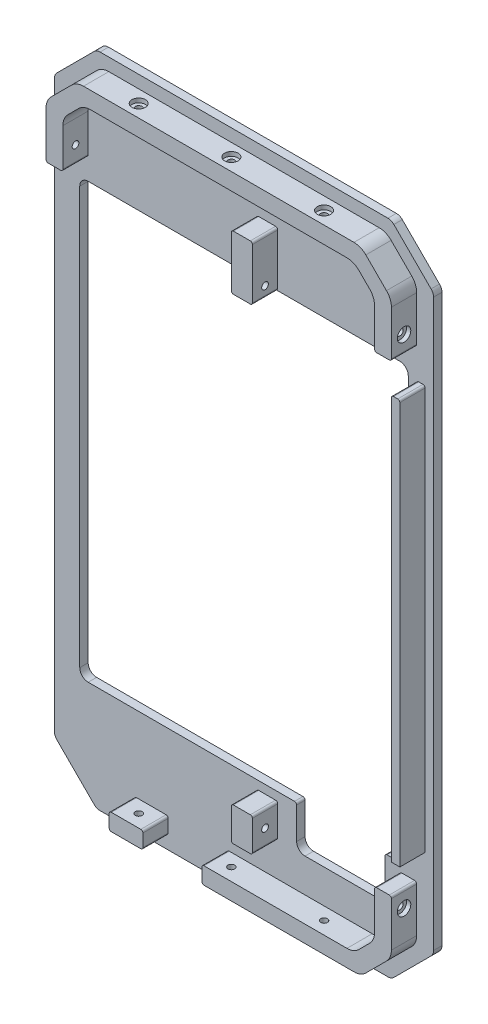
from build123d import *

# Parameters (mm, degrees)
SKETCH_1_W                = 90
SKETCH_1_H                = 156
EXTRUDE_1_DEPTH           = 2
CHAMFER_1_SIZE            = 10
EXTRUDE_2_DEPTH           = 6
SHELL_3_T                 = -4
SHELL_3_THICKNESS_2_DEPTH = 2
SKETCH_5_R                = 0.8
CUT_EXTRUDE_2088_DEPTH    = 200
SKETCH_25_W               = 15.521102544
SKETCH_25_H               = 165.941128128
SKETCH_25_W_2             = 34.04372952
CUT_EXTRUDE_17_DEPTH      = 6
SKETCH_8_W                = 109.527726605
SKETCH_8_H                = 110
CUT_EXTRUDE_3357_DEPTH    = 6
EXTRUDE_5_DEPTH           = 6
FILLET_4312_R             = 2
FILLET_4896_R             = 4
SKETCH_4_R                = 0.8
CUT_EXTRUDE_5906_DEPTH    = 100
SKETCH_6_W                = 5
SKETCH_6_H                = 13
SKETCH_6_H_2              = 8
EXTRUDE_3_DEPTH           = 6
CUT_EXTRUDE_START         = -10
SKETCH_17_R               = 0.8
CUT_EXTRUDE_7436_DEPTH    = 10
SKETCH_11_W               = 14
SKETCH_11_H               = 18.940292979
SKETCH_11_W_2             = 19
SKETCH_11_H_2             = 39.158001539
PCI_E_DEPTH               = 6
SKETCH_10_W               = 78
SKETCH_10_H               = 103
IO_2_DEPTH                = 10
SKETCH_15_W               = 21
SKETCH_15_H               = 10
CUT_EXTRUDE_10858_DEPTH   = 10
SKETCH_21_R               = 1.6
CUT_EXTRUDE_14_DEPTH      = 1
CUT_EXTRUDE_START_2       = -1
SKETCH_20_R               = 1.6
CUT_EXTRUDE_12604_DEPTH   = 1
SKETCH_22_R               = 1.6
CUT_EXTRUDE_15_DEPTH      = 1
SKETCH_23_R               = 1.6
CUT_EXTRUDE_16_DEPTH      = 1
SKETCH_26_W               = 2
SKETCH_26_H               = 96
EXTRUDE_4_DEPTH           = 6
FILLET_5_R                = 2
FILLET_7_R                = 0.5
FILLET_8_R                = 0.5


with BuildPart() as part:
    # 草图1 → 凸台-拉伸1 (new body)
    with BuildSketch(Plane.XY):
        with Locations((-45, 78)):
            Rectangle(SKETCH_1_W, SKETCH_1_H)
    extrude(amount=EXTRUDE_1_DEPTH)

    # 倒角1
    chamfer_1_edges = [part.edges().sort_by_distance(p)[0] for p in [
        (0, 0, 1),
        (-90, 0, 1),
        (-90, 156, 1),
        (0, 156, 1),
    ]]
    chamfer(chamfer_1_edges, length=CHAMFER_1_SIZE)

    # 草图2 → 凸台-拉伸2 (add)
    with BuildSketch(Plane.XY.offset(2)):
        Polygon((-78.757359313, 153), (-11.242640687, 153), (-3, 144.757359313), (-3, 11.242640687), (-11.242640687, 3), (-78.757359313, 3), (-87, 11.242640687), (-87, 144.757359313), align=None)
    extrude(amount=EXTRUDE_2_DEPTH)

    # 抽壳3
    shell_3_openings = [part.faces().sort_by_distance(p)[0] for p in [
        (-45, 78, 8),
    ]]
    offset(amount=SHELL_3_T, openings=shell_3_openings)

    # 抽壳3 thickness 2 face (on inner face of the shell) → 抽壳3 thickness 2 (cut)
    with BuildSketch(Plane(origin=(-45, 78, 4), x_dir=(-1, 0, 0), z_dir=(0, 0, -1))):
        Polygon((-32.100505063, 71), (32.100505063, 71), (38, 65.100505063), (38, -65.100505063), (32.100505063, -71), (-32.100505063, -71), (-38, -65.100505063), (-38, 65.100505063), align=None)
    extrude(amount=SHELL_3_THICKNESS_2_DEPTH, mode=Mode.SUBTRACT)

    # 草图5 → Cut-Extrude 2088 (cut)
    with BuildSketch(Plane(origin=(0, 3, 0), x_dir=(-1, 0, 0), z_dir=(0, -1, 0))):
        with Locations(Location((67, -5, 0), (0, 0, 90))):
            Circle(SKETCH_5_R)
        with Locations(Location((23, -5, 0), (0, 0, 90))):
            Circle(SKETCH_5_R)
        with Locations(Location((45, -5, 0), (0, 0, 90))):
            Circle(SKETCH_5_R)
    extrude(amount=-CUT_EXTRUDE_2088_DEPTH, mode=Mode.SUBTRACT)

    # 草图25 → 切除-拉伸17 (cut)
    with BuildSketch(Plane.XY.offset(8)):
        with Locations((-93.760551272, 70.734849479)):
            Rectangle(SKETCH_25_W, SKETCH_25_H)
        with Locations((13.02186476, 70.734849479)):
            Rectangle(SKETCH_25_W_2, SKETCH_25_H)
    extrude(amount=-CUT_EXTRUDE_17_DEPTH, mode=Mode.SUBTRACT)

    # 草图8 → Cut-Extrude 3357 (cut)
    with BuildSketch(Plane.XY.offset(8)):
        with Locations((-46.223461864, 78)):
            Rectangle(SKETCH_8_W, SKETCH_8_H)
    extrude(amount=-CUT_EXTRUDE_3357_DEPTH, mode=Mode.SUBTRACT)

    # 草图28 → 凸台-拉伸5 (add)
    with BuildSketch(Plane.XY.offset(2)):
        Polygon((-82, 143.100505063), (-82, 144.100505063), (-83, 143.100505063), (-83, 133), (-82, 133), align=None)
        Polygon((-8, 143.100505063), (-8, 144.100505063), (-7, 143.100505063), (-7, 133), (-8, 133), align=None)
        Polygon((-8, 12.899494937), (-8, 11.899494937), (-7, 12.899494937), (-7, 23), (-8, 23), align=None)
    extrude(amount=EXTRUDE_5_DEPTH)

    # Fillet 4312
    fillet_4312_edges = [part.edges().sort_by_distance(p)[0] for p in [
        (0, 146, 1),
        (0, 10, 1),
        (-80, 0, 1),
        (-10, 0, 1),
        (-90, 146, 1),
        (-90, 10, 1),
        (-10, 156, 1),
        (-80, 156, 1),
    ]]
    fillet(fillet_4312_edges, radius=FILLET_4312_R)

    # Fillet 4896
    fillet_4896_edges = [part.edges().sort_by_distance(p)[0] for p in [
        (-4, 145.757359313, 5),
        (-86, 10.242640687, 5),
        (-86, 145.757359313, 5),
        (-4, 10.242640687, 5),
        (-82, 144.100505063, 5),
        (-8, 144.100505063, 5),
        (-8, 11.899494937, 5),
        (-78.757359313, 153, 5),
        (-78.757359313, 3, 5),
        (-11.242640687, 3, 5),
        (-11.242640687, 153, 5),
        (-77.100505063, 149, 5),
        (-83, 12.899494937, 5),
        (-77.100505063, 7, 5),
        (-12.899494937, 7, 5),
        (-12.899494937, 149, 5),
    ]]
    fillet(fillet_4896_edges, radius=FILLET_4896_R)

    # 草图4 → Cut-Extrude 5906 (cut)
    with BuildSketch(Plane.ZY.offset(87)):
        with Locations(Location((5, 137, 0), (0, 0, 270))):
            Circle(SKETCH_4_R)
        with Locations(Location((5, 19, 0), (0, 0, 270))):
            Circle(SKETCH_4_R)
    extrude(amount=-CUT_EXTRUDE_5906_DEPTH, mode=Mode.SUBTRACT)

    # 草图6 → 凸台-拉伸3 (add)
    with BuildSketch(Plane.XY.offset(2)):
        with Locations((-39.5, 134.5)):
            Rectangle(SKETCH_6_W, SKETCH_6_H)
        with Locations((-39.5, 19)):
            Rectangle(SKETCH_6_W, SKETCH_6_H_2)
    extrude(amount=EXTRUDE_3_DEPTH)

    # 草图17 → Cut-Extrude 7436 (cut)
    with BuildSketch(Plane(origin=(-37, 0, 0), x_dir=(0, 0, -1), z_dir=(1, 0, 0)).offset(CUT_EXTRUDE_START)):
        with Locations((-5, 130.5)):
            Circle(SKETCH_17_R)
        with Locations(Location((-5, 19, 0), (0, 0, 270))):
            Circle(SKETCH_17_R)
    extrude(amount=CUT_EXTRUDE_7436_DEPTH, mode=Mode.SUBTRACT)

    # 草图11 → PCI-E (cut)
    with BuildSketch(Plane.XY.offset(8)):
        with Locations((-56, 6.415224672)):
            Rectangle(SKETCH_11_W, SKETCH_11_H)
        with Locations((-80.5, 14.172145087)):
            Rectangle(SKETCH_11_W_2, SKETCH_11_H_2)
    extrude(amount=-PCI_E_DEPTH, mode=Mode.SUBTRACT)

    # 草图10 → IO 2 (cut)
    with BuildSketch(Plane.XY.offset(8)):
        with Locations((-45, 76.5)):
            Rectangle(SKETCH_10_W, SKETCH_10_H)
    extrude(amount=-IO_2_DEPTH, mode=Mode.SUBTRACT)

    # 草图15 → Cut-Extrude 10858 (cut)
    with BuildSketch(Plane(origin=(0, 0, 0), x_dir=(-1, 0, 0), z_dir=(0, 0, -1))):
        with Locations((22, 20)):
            Rectangle(SKETCH_15_W, SKETCH_15_H)
    extrude(amount=-CUT_EXTRUDE_10858_DEPTH, mode=Mode.SUBTRACT)

    # 草图21 → 切除-拉伸14 (cut)
    with BuildSketch(Plane(origin=(0, 3, 0), x_dir=(-1, 0, 0), z_dir=(0, -1, 0))):
        with Locations(Location((67, -5, 0), (0, 0, 90))):
            Circle(SKETCH_21_R)
        with Locations(Location((45, -5, 0), (0, 0, 90))):
            Circle(SKETCH_21_R)
        with Locations(Location((23, -5, 0), (0, 0, 90))):
            Circle(SKETCH_21_R)
    extrude(amount=-CUT_EXTRUDE_14_DEPTH, mode=Mode.SUBTRACT)

    # 草图20 → Cut-Extrude 12604 (cut)
    with BuildSketch(Plane(origin=(0, 153, 0), x_dir=(1, 0, 0), z_dir=(0, 1, 0)).offset(CUT_EXTRUDE_START_2)):
        with Locations(Location((-67, -5, 0), (0, 0, 90))):
            Circle(SKETCH_20_R)
        with Locations(Location((-45, -5, 0), (0, 0, 90))):
            Circle(SKETCH_20_R)
        with Locations(Location((-23, -5, 0), (0, 0, 90))):
            Circle(SKETCH_20_R)
    extrude(amount=CUT_EXTRUDE_12604_DEPTH, mode=Mode.SUBTRACT)

    # 草图22 → 切除-拉伸15 (cut)
    with BuildSketch(Plane.ZY.offset(86)):
        with Locations(Location((5, 137, 0), (0, 0, 270))):
            Circle(SKETCH_22_R)
        with Locations((5, 19)):
            Circle(SKETCH_22_R)
    extrude(amount=-CUT_EXTRUDE_15_DEPTH, mode=Mode.SUBTRACT)

    # 草图23 → 切除-拉伸16 (cut)
    with BuildSketch(Plane(origin=(-4, 0, 0), x_dir=(0, 0, -1), z_dir=(1, 0, 0)).offset(CUT_EXTRUDE_START_2)):
        with Locations(Location((-5, 137, 0), (0, 0, 270))):
            Circle(SKETCH_23_R)
        with Locations(Location((-5, 19, 0), (0, 0, 90))):
            Circle(SKETCH_23_R)
    extrude(amount=CUT_EXTRUDE_16_DEPTH, mode=Mode.SUBTRACT)

    # 草图26 → 凸台-拉伸4 (add)
    with BuildSketch(Plane.XY.offset(2)):
        with Locations((-3, 78)):
            Rectangle(SKETCH_26_W, SKETCH_26_H)
    extrude(amount=EXTRUDE_4_DEPTH)

    # 圆角5
    fillet_5_edges = [part.edges().sort_by_distance(p)[0] for p in [
        (-84, 25, 1),
        (-6, 128, 1),
        (-6, 25, 1),
        (-84, 128, 1),
        (-11.5, 15, 1),
        (-32.5, 15, 1),
    ]]
    fillet(fillet_5_edges, radius=FILLET_5_R)

    # 圆角7
    fillet_7_edges = [part.edges().sort_by_distance(p)[0] for p in [
        (-32.5, 25, 1),
        (-11.5, 25, 1),
    ]]
    fillet(fillet_7_edges, radius=FILLET_7_R)

    # 圆角8
    fillet_8_edges = [part.edges().sort_by_distance(p)[0] for p in [
        (-86, 133, 5),
        (-4, 23, 5),
        (-4, 133, 5),
        (-82, 133, 5),
        (-8, 133, 5),
        (-8, 23, 5),
        (-42, 141, 5),
        (-42, 128, 5),
        (-37, 128, 5),
        (-37, 141, 5),
        (-37, 15, 5),
        (-37, 23, 5),
        (-42, 23, 5),
        (-42, 15, 5),
        (-49, 7, 5),
        (-63, 7, 5),
        (-71, 7, 5),
        (-71, 3, 5),
        (-63, 3, 5),
        (-49, 3, 5),
        (-4, 126, 5),
        (-2, 126, 5),
    ]]
    fillet(fillet_8_edges, radius=FILLET_8_R)


solid = part.part
